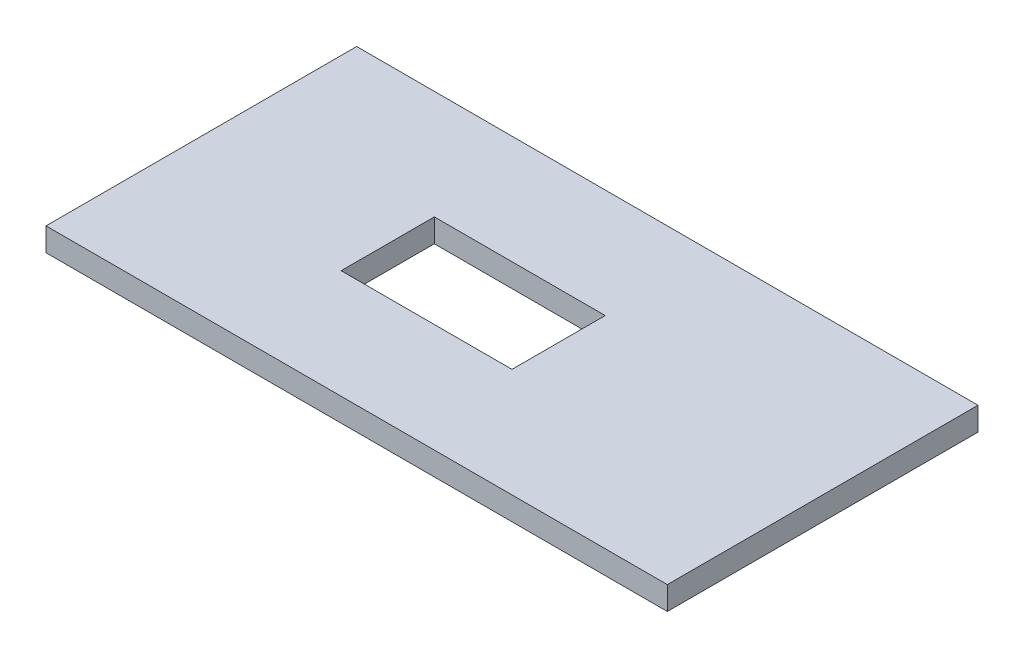
from build123d import *

# Parameters (mm, degrees)
SKETCH1_W           = 80
SKETCH1_H           = 40
SKETCH1_W_2         = 22
SKETCH1_H_2         = 12
BOSS_EXTRUDE1_DEPTH = 3


with BuildPart() as part:
    # Sketch1 → Boss-Extrude1 (new body)
    with BuildSketch(Plane(origin=(0, 0, 0), x_dir=(1, 0, 0), z_dir=(0, 1, 0))):
        with Locations((40, 20)):
            Rectangle(SKETCH1_W, SKETCH1_H)
        with Locations((35, 20)):
            Rectangle(SKETCH1_W_2, SKETCH1_H_2, mode=Mode.SUBTRACT)
    extrude(amount=BOSS_EXTRUDE1_DEPTH)


solid = part.part
